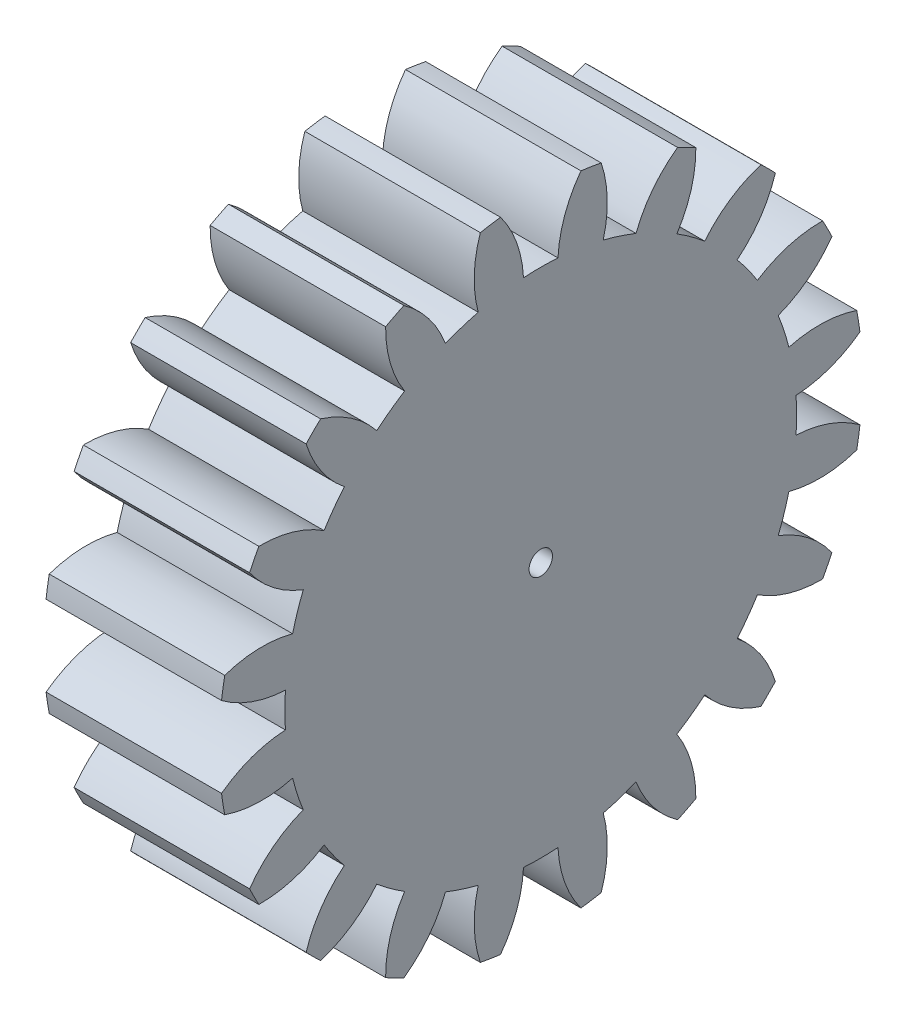
from build123d import *

# Parameters (mm, degrees)
BASPROSKE_W     = 6
BASPROSKE_H     = 11
TOOTHCUT_DEPTH  = 17.673332001
TEETHCUTS_COUNT = 20
TEETHCUTS_ANGLE = 342
BORSKE_R        = 0.4
BORE_DEPTH      = 50.0000508


with BuildPart() as part:
    # BasProSke → Base-Revolve (revolve)
    with BuildSketch(Plane(origin=(0, 0, 0), x_dir=(1, 0, 0), z_dir=(0, 1, 0)), mode=Mode.PRIVATE) as base_revolve_sk:
        with Locations((3, 5.5)):
            Rectangle(BASPROSKE_W, BASPROSKE_H)
    revolve(base_revolve_sk.sketch.rotate(Axis((-10, 0, 0), (1, 0, 0)), 180), axis=Axis((-10, 0, 0), (1, 0, 0)))

    # TooCutSke → ToothCut (cut, through all)
    with BuildSketch(Plane(origin=(0, 0, 0), x_dir=(0, 0, -1), z_dir=(1, 0, 0))):
        with BuildLine():
            ThreePointArc((0.589353609, 8.729127295), (0, 8.749), (-0.589353609, 8.729127295))
            ThreePointArc((-0.589353609, 8.729127295), (-0.82475631, 9.893403384), (-1.391689312, 10.937213814))
            ThreePointArc((-1.391689312, 10.937213814), (0, 11.0254), (1.391689312, 10.937213814))
            ThreePointArc((1.391689312, 10.937213814), (0.82475631, 9.893403384), (0.589353609, 8.729127295))
        make_face()
    toothcut = extrude(amount=TOOTHCUT_DEPTH, mode=Mode.SUBTRACT)

    # TeethCuts: ToothCut ×20 about axis
    teethcuts_axis = Axis((-10, 0, 0), (1, 0, 0))
    for i in range(1, TEETHCUTS_COUNT):
        add(toothcut.rotate(teethcuts_axis, i * TEETHCUTS_ANGLE / (TEETHCUTS_COUNT - 1)), mode=Mode.SUBTRACT)

    # BorSke → Bore (cut, symmetric)
    with BuildSketch(Plane(origin=(0, 0, 0), x_dir=(0, 0, -1), z_dir=(1, 0, 0))):
        with Locations(Location((0, 0, 0), (0, 0, 180))):
            Circle(BORSKE_R)
    extrude(amount=BORE_DEPTH, both=True, mode=Mode.SUBTRACT)


solid = part.part
